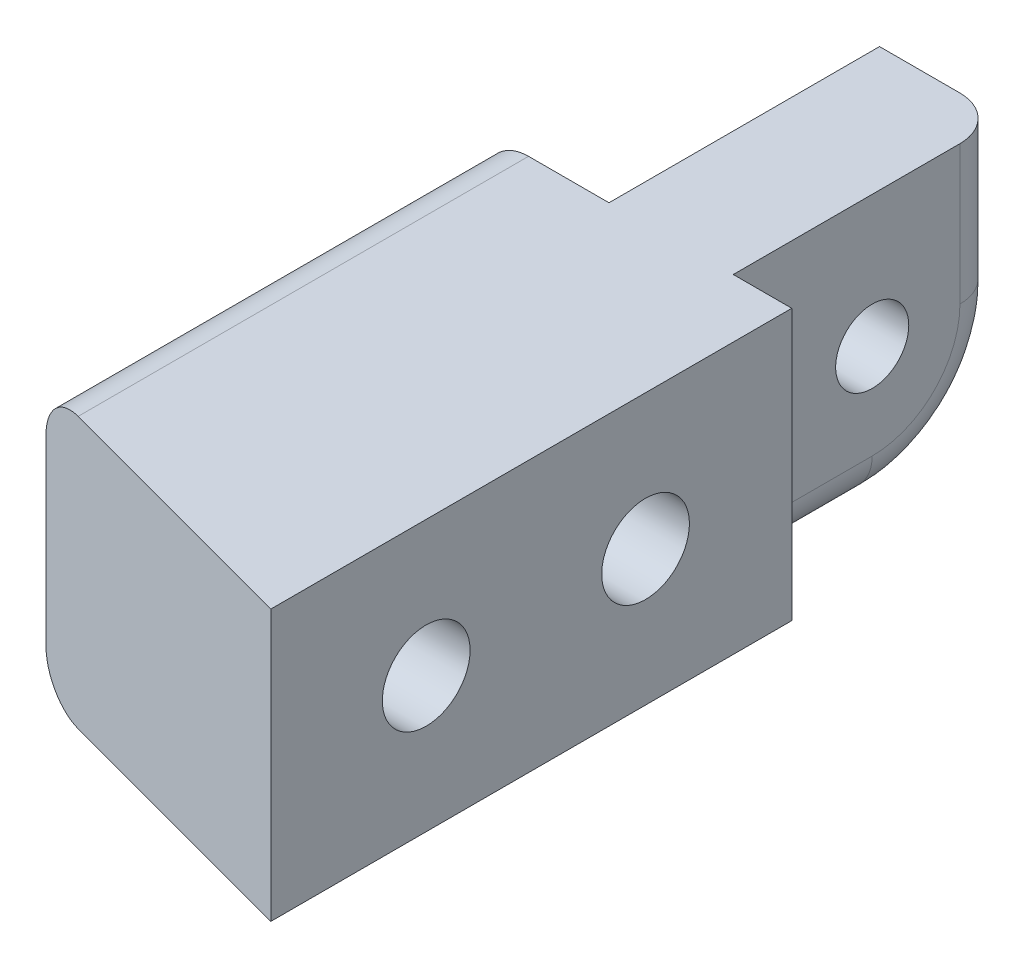
from build123d import *

# Parameters (mm, degrees)
BOSS_EXTRUDE1_DEPTH       = 18.5
CUT_EXTRUDE1_DEPTH        = 55.621424368
CUT_EXTRUDE1_DEPTH_BACK   = 8.5
FILLET1_R                 = 3
F_4_0MM_DOWEL_HOLE1_D     = 4
F_4_0MM_DOWEL_HOLE1_DEPTH = 31.5
F_4_0MM_DOWEL_HOLE1_TIP   = 1.201721238
CUT_EXTRUDE3_DEPTH        = 3.5
F_6_0MM_DOWEL_HOLE1_D     = 6
FILLET3_R                 = 3
F_5_0MM_DOWEL_HOLE1_D     = 5


with BuildPart() as part:
    # Sketch2 → Boss-Extrude1 (new body)
    with BuildSketch(Plane(origin=(0, 0, 0), x_dir=(1, 0, 0), z_dir=(0, 1, 0))):
        Polygon((-10.5, 30), (-10.5, 0), (10.5, -5.626933041), (10.5, 30), (6.5, 30), (6.5, 48.5), (-2, 48.5), (-2, 30), align=None)
    extrude(amount=BOSS_EXTRUDE1_DEPTH)

    # Sketch3 → Cut-Extrude1 (cut, two sides: drawn at the far end of the back side and taken through both)
    with BuildSketch(Plane(origin=(6.5, 0, 0), x_dir=(0, 0, -1), z_dir=(1, 0, 0)).offset(-CUT_EXTRUDE1_DEPTH_BACK)):
        with BuildLine():
            Line((-80.408596214, 0), (39.5, 0))
            ThreePointArc((39.5, 0), (45.863961031, 2.636038969), (48.5, 9))
            Line((48.5, 9), (48.5, 128.908596214))
            Line((48.5, 128.908596214), (218.076363011, -40.667766797))
            Line((218.076363011, -40.667766797), (89.167766797, -169.576363011))
            Line((89.167766797, -169.576363011), (-80.408596214, 0))
        make_face()
    extrude(amount=CUT_EXTRUDE1_DEPTH + CUT_EXTRUDE1_DEPTH_BACK, mode=Mode.SUBTRACT)

    # Fillet1
    fillet1_edges = [part.edges().sort_by_distance(p)[0] for p in [
        (6.5, 13.75, -48.5),
        (6.5, 2.636038969, -45.863961031),
        (6.5, 0, -34.75),
    ]]
    fillet(fillet1_edges, radius=FILLET1_R)

    # Ø4.0mm Dowel Hole1
    with Locations(Plane(origin=(0, 0, -48.5), x_dir=(-1, 0, 0), z_dir=(0, 0, -1))):
        with Locations((-2.25, 3.5)):
            Hole(F_4_0MM_DOWEL_HOLE1_D / 2, depth=F_4_0MM_DOWEL_HOLE1_DEPTH)
            with Locations((0, 0, -(F_4_0MM_DOWEL_HOLE1_DEPTH + F_4_0MM_DOWEL_HOLE1_TIP / 2))):  # 118° drill point
                Cone(0, F_4_0MM_DOWEL_HOLE1_D / 2, F_4_0MM_DOWEL_HOLE1_TIP, mode=Mode.SUBTRACT)

    # Sketch8 → Cut-Extrude3 (cut)
    with BuildSketch(Plane.XZ):
        with BuildLine():
            Line((0.25, -48.5), (4.25, -48.5))
            Line((4.25, -48.5), (4.25, -31.5))
            ThreePointArc((4.25, -31.5), (2.25, -29.5), (0.25, -31.5))
            Line((0.25, -31.5), (0.25, -48.5))
        make_face()
        with BuildLine():
            Line((0.25, -22.5), (0.25, -19))
            ThreePointArc((0.25, -19), (2.25, -17), (4.25, -19))
            Line((4.25, -19), (4.25, -22.5))
            ThreePointArc((4.25, -22.5), (2.25, -24.5), (0.25, -22.5))
        make_face()
    extrude(amount=-CUT_EXTRUDE3_DEPTH, mode=Mode.SUBTRACT)

    # Ø6.0mm Dowel Hole1 (through all)
    with Locations(Plane(origin=(10.5, 0, 0), x_dir=(0, 0, -1), z_dir=(1, 0, 0))):
        with Locations((20, 9.25), (5, 9.25)):
            Hole(F_6_0MM_DOWEL_HOLE1_D / 2)

    # Fillet3
    fillet3_edges = [part.edges().sort_by_distance(p)[0] for p in [
        (-10.5, 0, -15),
        (-10.5, 18.5, -15),
    ]]
    fillet(fillet3_edges, radius=FILLET3_R)

    # Ø5.0mm Dowel Hole1 (through all)
    with Locations(Plane(origin=(6.5, 0, 0), x_dir=(0, 0, -1), z_dir=(1, 0, 0))):
        with Locations((39.5, 9.5)):
            Hole(F_5_0MM_DOWEL_HOLE1_D / 2)


solid = part.part
